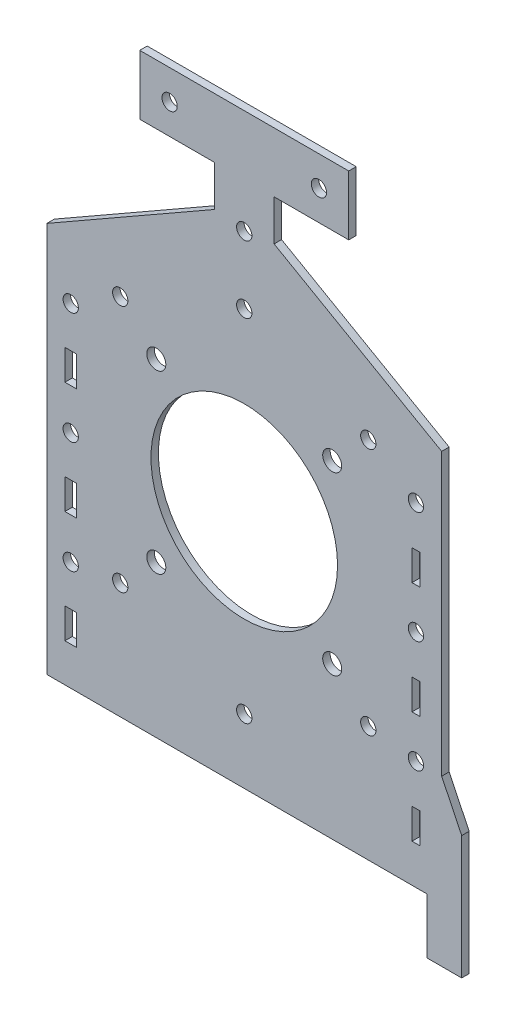
from build123d import *

# Parameters (mm, degrees)
SKETCH_1_W      = 3.1
SKETCH_1_H      = 8.1
SKETCH_1_R      = 2.05
SKETCH_1_R_2    = 2.55
SKETCH_1_R_3    = 25
SKETCH_1_W_2    = 2.1
EXTRUDE_1_DEPTH = 2


with BuildPart() as part:
    # 草图1 → 凸台-拉伸1 (new body)
    with BuildSketch(Plane.XY):
        Polygon((52.9, -21.5), (52.9, 53.883164809), (8, 79.569735886), (8, 90.5), (28, 90.5), (28, 106.5), (-28, 106.5), (-28, 90.5), (-8, 90.5), (-8, 79.569735886), (-52.9, 53.883164809), (-52.9, -50.79), (-43.709229173, -50.79), (-34.403358285, -50.79), (48.918692166, -50.79), (48.918692166, -65.64215863), (58.26995581, -65.64215863), (58.26995581, -32.590877477), align=None)
        with Locations((-46.5, -36.5)):
            Rectangle(SKETCH_1_W, SKETCH_1_H, mode=Mode.SUBTRACT)
        with Locations((0, -33.5)):
            Circle(SKETCH_1_R, mode=Mode.SUBTRACT)
        with Locations((-46.5, -21.5)):
            Circle(SKETCH_1_R, mode=Mode.SUBTRACT)
        with Locations((-46.5, -6.5)):
            Rectangle(SKETCH_1_W, SKETCH_1_H, mode=Mode.SUBTRACT)
        with Locations((-33.234018716, -19.734018716)):
            Circle(SKETCH_1_R, mode=Mode.SUBTRACT)
        with Locations((-46.5, 8.5)):
            Circle(SKETCH_1_R, mode=Mode.SUBTRACT)
        with Locations((-23.57, -10.07)):
            Circle(SKETCH_1_R_2, mode=Mode.SUBTRACT)
        with Locations((0, 13.5)):
            Circle(SKETCH_1_R_3, mode=Mode.SUBTRACT)
        with Locations((46, -36.5)):
            Rectangle(SKETCH_1_W_2, SKETCH_1_H, mode=Mode.SUBTRACT)
        with Locations((23.57, -10.07)):
            Circle(SKETCH_1_R_2, mode=Mode.SUBTRACT)
        with Locations((33.234018716, -19.734018716)):
            Circle(SKETCH_1_R, mode=Mode.SUBTRACT)
        with Locations((46, -21.5)):
            Circle(SKETCH_1_R, mode=Mode.SUBTRACT)
        with Locations((46, -6.5)):
            Rectangle(SKETCH_1_W_2, SKETCH_1_H, mode=Mode.SUBTRACT)
        with Locations((46, 8.5)):
            Circle(SKETCH_1_R, mode=Mode.SUBTRACT)
        with Locations((-46.5, 23.5)):
            Rectangle(SKETCH_1_W, SKETCH_1_H, mode=Mode.SUBTRACT)
        with Locations((-46.5, 38.5)):
            Circle(SKETCH_1_R, mode=Mode.SUBTRACT)
        with Locations((-33.234018716, 46.734018716)):
            Circle(SKETCH_1_R, mode=Mode.SUBTRACT)
        with Locations((-23.57, 37.07)):
            Circle(SKETCH_1_R_2, mode=Mode.SUBTRACT)
        with Locations((0, 60.5)):
            Circle(SKETCH_1_R, mode=Mode.SUBTRACT)
        with Locations((0, 78.5)):
            Circle(SKETCH_1_R, mode=Mode.SUBTRACT)
        with Locations((-20, 98.5)):
            Circle(SKETCH_1_R, mode=Mode.SUBTRACT)
        with Locations((23.57, 37.07)):
            Circle(SKETCH_1_R_2, mode=Mode.SUBTRACT)
        with Locations((46, 23.5)):
            Rectangle(SKETCH_1_W_2, SKETCH_1_H, mode=Mode.SUBTRACT)
        with Locations((46, 38.5)):
            Circle(SKETCH_1_R, mode=Mode.SUBTRACT)
        with Locations((33.234018716, 46.734018716)):
            Circle(SKETCH_1_R, mode=Mode.SUBTRACT)
        with Locations((20, 98.5)):
            Circle(SKETCH_1_R, mode=Mode.SUBTRACT)
    extrude(amount=EXTRUDE_1_DEPTH)


solid = part.part
